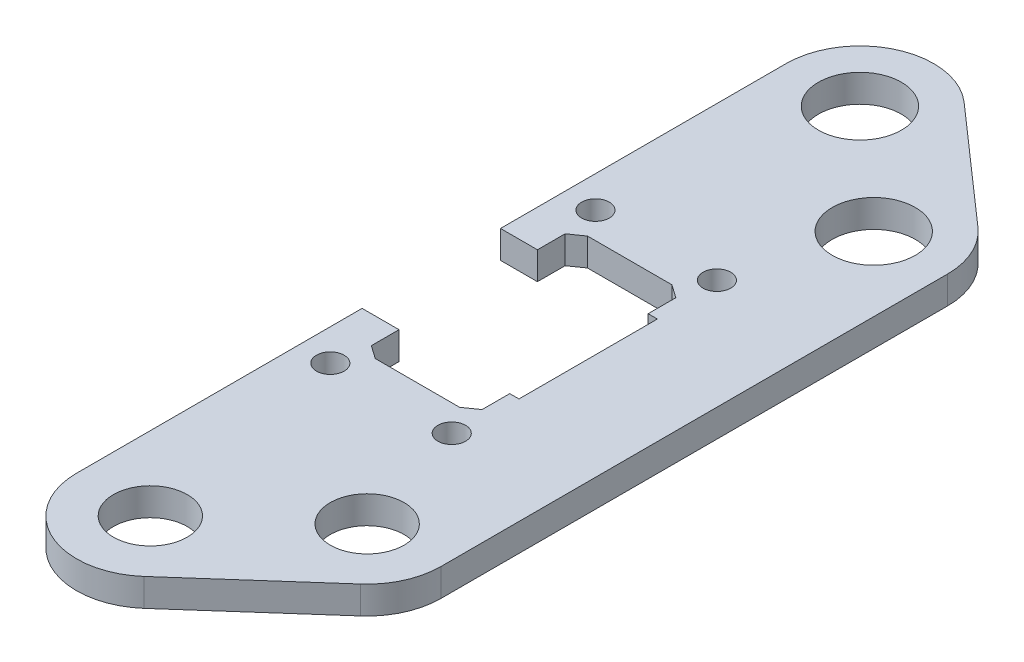
from build123d import *

# Parameters (mm, degrees)
SKETCH1_R           = 4.5
SKETCH1_R_2         = 1.5
BOSS_EXTRUDE1_DEPTH = 3
BOSS_EXTRUDE2_START = -3
SKETCH3_R           = 4.5
SKETCH3_R_2         = 4
BOSS_EXTRUDE2_DEPTH = 3


with BuildPart() as part:
    # Sketch1 → Boss-Extrude1 (new body)
    with BuildSketch(Plane(origin=(0, 0, 0), x_dir=(1, 0, 0), z_dir=(0, 1, 0))):
        with BuildLine():
            Line((-6, -7.5), (-10, -7.5))
            Line((-10, -7.5), (-10, -8.75))
            Line((-10, -8.75), (-10, -38.449422848))
            ThreePointArc((-10, -38.449422848), (-5.277416427, -45.767940555), (3.336657191, -44.479052382))
            Line((3.336657191, -44.479052382), (15.796770322, -33.445350211))
            ThreePointArc((15.796770322, -33.445350211), (17.792942369, -30.73831136), (18.5, -27.450024315))
            Line((18.5, -27.450024315), (18.5, 27.45))
            ThreePointArc((18.5, 27.45), (17.789725141, 30.745437355), (15.785023159, 33.455708135))
            Line((15.785023159, 33.455708135), (3.285023159, 44.455708135))
            ThreePointArc((3.285023159, 44.455708135), (-5.295437355, 45.739725141), (-10, 38.45))
            Line((-10, 38.45), (-10, 8.75))
            Line((-10, 8.75), (-10, 7.5))
            Line((-10, 7.5), (-6, 7.5))
            Line((-6, 7.5), (-6, 10.5))
            Line((-6, 10.5), (-4.571851993, 11.5))
            Line((-4.571851993, 11.5), (4.571851993, 11.5))
            Line((4.571851993, 11.5), (6, 10.5))
            Line((6, 10.5), (6, 7.5))
            Line((6, 7.5), (7, 7.5))
            Line((7, 7.5), (7, 0))
            Line((7, 0), (7, -7.5))
            Line((7, -7.5), (6, -7.5))
            Line((6, -7.5), (6, -10.5))
            Line((6, -10.5), (4.571851993, -11.5))
            Line((4.571851993, -11.5), (-4.571851993, -11.5))
            Line((-4.571851993, -11.5), (-6, -10.5))
            Line((-6, -10.5), (-6, -7.5))
        make_face()
        with Locations(Location((-2, -38.45, 0), (0, 0, 270))):
            Circle(SKETCH1_R, mode=Mode.SUBTRACT)
        with Locations(Location((-6.57936952, -14.367032155, 0), (0, 0, 270))):
            Circle(SKETCH1_R_2, mode=Mode.SUBTRACT)
        with Locations(Location((10.5, -27.45, 0), (0, 0, 270))):
            Circle(SKETCH1_R, mode=Mode.SUBTRACT)
        with Locations(Location((6.57936952, -14.367032155, 0), (0, 0, 270))):
            Circle(SKETCH1_R_2, mode=Mode.SUBTRACT)
        with Locations(Location((-6.57936952, 14.367032155, 0), (0, 0, 270))):
            Circle(SKETCH1_R_2, mode=Mode.SUBTRACT)
        with Locations(Location((-2, 38.45, 0), (0, 0, 270))):
            Circle(SKETCH1_R, mode=Mode.SUBTRACT)
        with Locations(Location((6.57936952, 14.367032155, 0), (0, 0, 270))):
            Circle(SKETCH1_R_2, mode=Mode.SUBTRACT)
        with Locations(Location((10.5, 27.45, 0), (0, 0, 270))):
            Circle(SKETCH1_R, mode=Mode.SUBTRACT)
    extrude(amount=BOSS_EXTRUDE1_DEPTH)

    # Sketch3 → Boss-Extrude2 (add)
    # profile 1 of 2: a face of its own
    with BuildSketch(Plane(origin=(0, 3, 0), x_dir=(1, 0, 0), z_dir=(0, 1, 0)).offset(BOSS_EXTRUDE2_START)):
        with Locations((-2, -38.45)):
            Circle(SKETCH3_R)
        with Locations(Location((-2, -38.45, 0), (0, 0, 270))):
            Circle(SKETCH3_R_2, mode=Mode.SUBTRACT)
    # profile 2 of 2: a face of its own
    with BuildSketch(Plane(origin=(0, 3, 0), x_dir=(1, 0, 0), z_dir=(0, 1, 0)).offset(BOSS_EXTRUDE2_START)):
        with Locations((10.5, -27.45)):
            Circle(SKETCH3_R)
        with Locations(Location((10.5, -27.45, 0), (0, 0, 270))):
            Circle(SKETCH3_R_2, mode=Mode.SUBTRACT)
    extrude(amount=BOSS_EXTRUDE2_DEPTH)


solid = part.part
